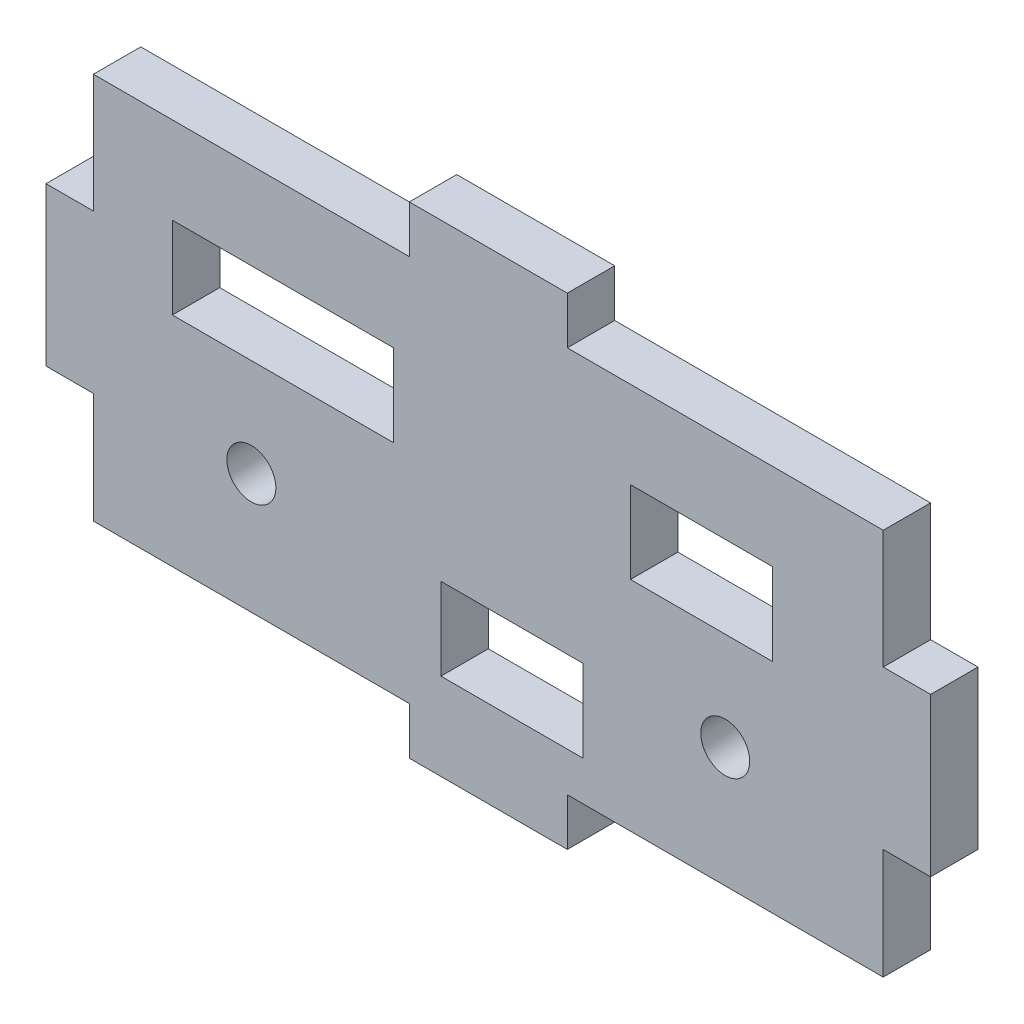
from build123d import *

# Parameters (mm, degrees)
BOSS_EXTRUDE1_DEPTH = 3
SKETCH4_R           = 1.55
SKETCH4_W           = 9
SKETCH4_H           = 5.2
SKETCH4_W_2         = 14
CUT_EXTRUDE1_DEPTH  = 3


with BuildPart() as part:
    # Sketch1 → Boss-Extrude1 (new body)
    with BuildSketch(Plane(origin=(0, 0, 0), x_dir=(-1, 0, 0), z_dir=(0, 0, 1))):
        Polygon((-3.476318152, -7.837615564), (-3.476318152, -4.837615564), (6.523681848, -4.837615564), (6.523681848, -7.837615564), (26.523681848, -7.837615564), (26.523681848, -14.837615564), (29.523681848, -14.837615564), (29.523681848, -24.837615564), (26.523681848, -24.837615564), (26.523681848, -32.337615564), (6.523681848, -32.337615564), (6.523681848, -35.337615564), (-3.476318152, -35.337615564), (-3.476318152, -32.337615564), (-23.476318152, -32.337615564), (-23.476318152, -24.837615564), (-26.476318152, -24.837615564), (-26.476318152, -14.837615564), (-23.476318152, -14.837615564), (-23.476318152, -7.837615564), align=None)
    extrude(amount=BOSS_EXTRUDE1_DEPTH)

    # Sketch4 → Cut-Extrude1 (cut)
    with BuildSketch(Plane.XY.offset(3)):
        with Locations((13.476318152, 15.437615564)):
            Circle(SKETCH4_R)
        with Locations(Location((-16.523681848, 15.437615564, 0), (0, 0, 180))):
            Circle(SKETCH4_R)
        with Locations((-0.023681848, 12.937615564)):
            Rectangle(SKETCH4_W, SKETCH4_H)
        with Locations((11.976318152, 24.237615564)):
            Rectangle(SKETCH4_W, SKETCH4_H)
        with Locations((-14.523681848, 24.237615564)):
            Rectangle(SKETCH4_W_2, SKETCH4_H)
    extrude(amount=-CUT_EXTRUDE1_DEPTH, mode=Mode.SUBTRACT)


solid = part.part
